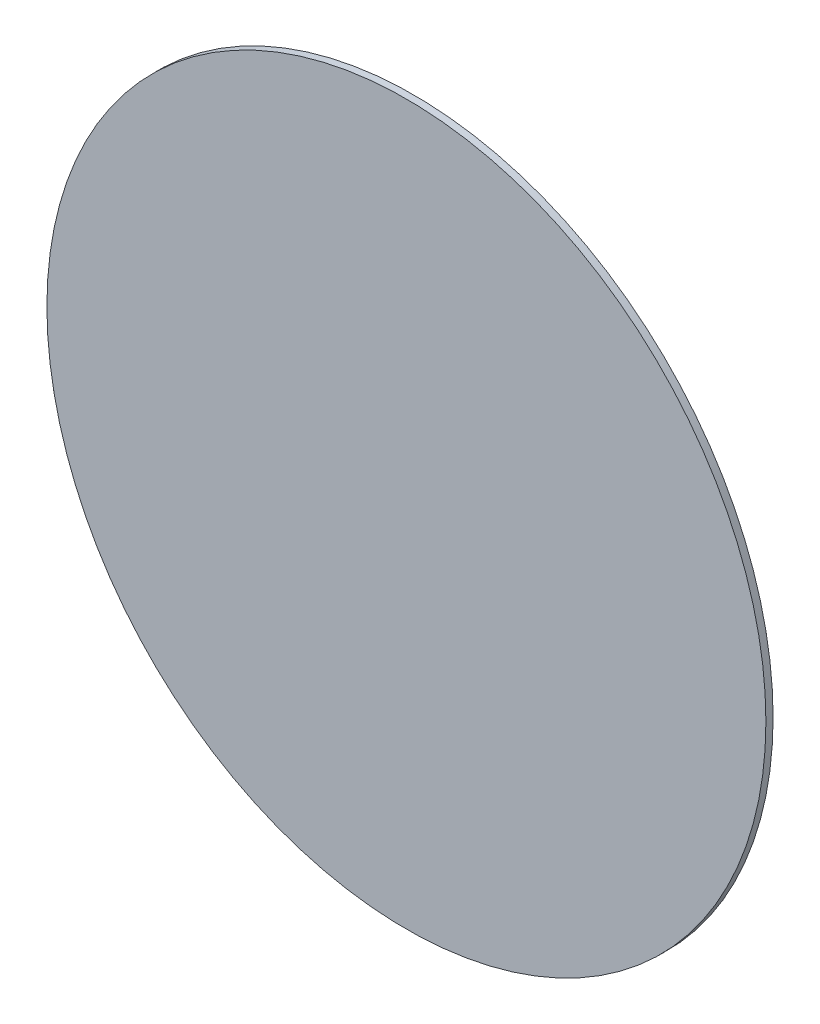
from build123d import *

# Parameters (mm, degrees)
SKIZZE1_R                       = 50
AUFSATZ_LINEAR_AUSTRAGEN1_DEPTH = 1


with BuildPart() as part:
    # Skizze1 → Aufsatz-Linear austragen1 (new body)
    with BuildSketch(Plane.XY):
        Circle(SKIZZE1_R)
    extrude(amount=AUFSATZ_LINEAR_AUSTRAGEN1_DEPTH)


solid = part.part
